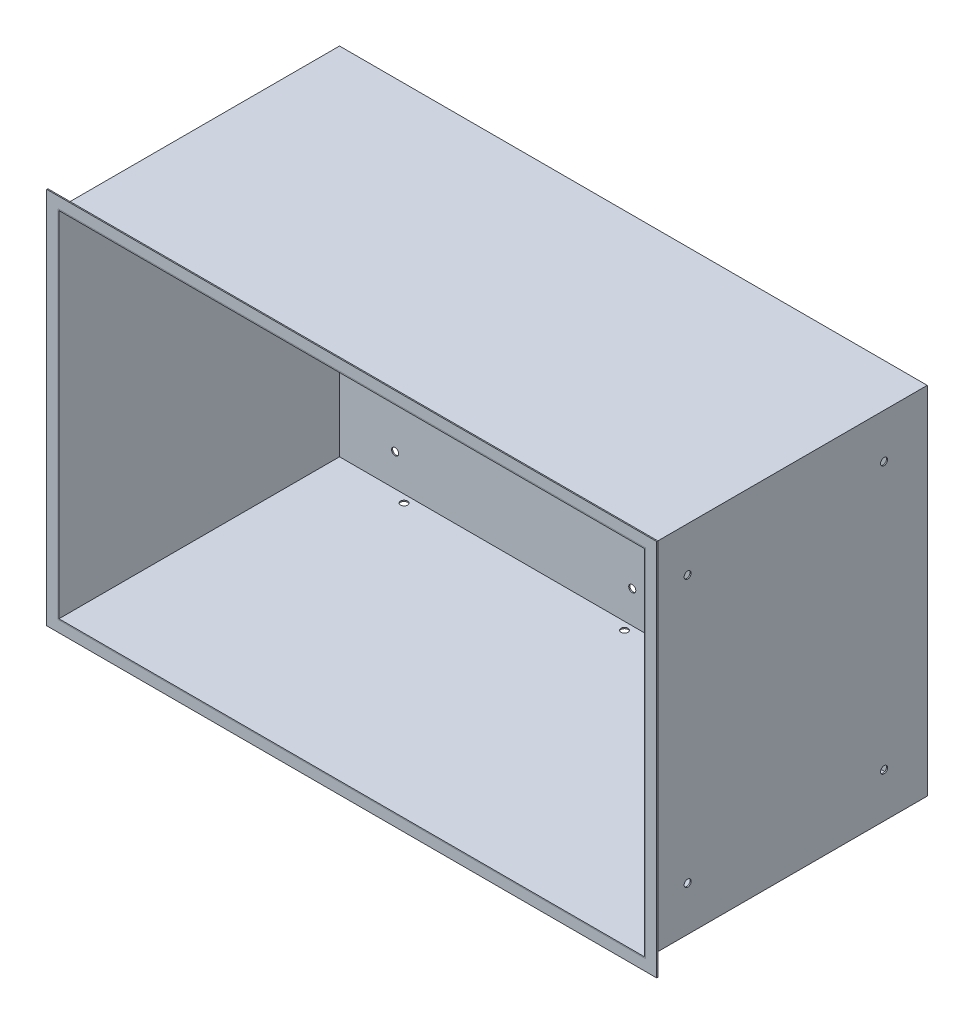
from build123d import *

# Parameters (mm, degrees)
CROQUIS1_W              = 793
CROQUIS1_H              = 380
SALIENTE_EXTRUIR1_DEPTH = 480
VACIADO1_T              = -1.52
CROQUIS2_W              = 823
CROQUIS2_H              = 510
CROQUIS2_W_2            = 793
CROQUIS2_H_2            = 480
SALIENTE_EXTRUIR2_DEPTH = 1.52
CROQUIS3_R              = 4.765
CROQUIS3_R_2            = 4.7625
CORTAR_EXTRUIR1_DEPTH   = 10
CROQUIS4_R              = 4.765
CROQUIS4_R_2            = 4.7625
CORTAR_EXTRUIR2_DEPTH   = 10
CROQUIS5_R              = 4.7625
CORTAR_EXTRUIR3_DEPTH   = 10
CROQUIS6_R              = 12.7
CORTAR_EXTRUIR4_DEPTH   = 10


with BuildPart() as part:
    # Croquis1 → Saliente-Extruir1 (new body)
    with BuildSketch(Plane(origin=(0, 0, 0), x_dir=(1, 0, 0), z_dir=(0, 1, 0))):
        Rectangle(CROQUIS1_W, CROQUIS1_H)
    extrude(amount=SALIENTE_EXTRUIR1_DEPTH)

    # Vaciado1
    vaciado1_openings = [part.faces().sort_by_distance(p)[0] for p in [
        (0, 240, 190),
    ]]
    offset(amount=VACIADO1_T, openings=vaciado1_openings, kind=Kind.INTERSECTION)

    # Croquis3 → Cortar-Extruir1 (cut)
    with BuildSketch(Plane(origin=(396.5, 0, 0), x_dir=(0, 0, -1), z_dir=(1, 0, 0))):
        with Locations((131.74, 60)):
            Circle(CROQUIS3_R)
        with Locations((-133.26, 60)):
            Circle(CROQUIS3_R_2)
        with Locations(Location((131.74, 420, 0), (0, 0, 180))):
            Circle(CROQUIS3_R)
        with Locations(Location((-133.26, 420, 0), (0, 0, 180))):
            Circle(CROQUIS3_R_2)
    extrude(amount=-CORTAR_EXTRUIR1_DEPTH, mode=Mode.SUBTRACT)

    # Croquis4 → Cortar-Extruir2 (cut)
    with BuildSketch(Plane.XY.offset(-188.48)):
        with Locations((-320, 435)):
            Circle(CROQUIS4_R)
        with Locations((-320, 240)):
            Circle(CROQUIS4_R_2)
        with Locations((-320, 45)):
            Circle(CROQUIS4_R)
        with Locations((320, 45)):
            Circle(CROQUIS4_R)
        with Locations((320, 435)):
            Circle(CROQUIS4_R)
        with Locations((320, 240)):
            Circle(CROQUIS4_R_2)
        with Locations((0, 45)):
            Circle(CROQUIS4_R)
        with Locations((0, 435)):
            Circle(CROQUIS4_R)
    extrude(amount=-CORTAR_EXTRUIR2_DEPTH, mode=Mode.SUBTRACT)

    # Croquis5 → Cortar-Extruir3 (cut)
    with BuildSketch(Plane.XZ):
        with Locations(Location((-297.375, -178, 0), (0, 0, 270))):
            Circle(CROQUIS5_R)
        with Locations(Location((0, -178, 0), (0, 0, 270))):
            Circle(CROQUIS5_R)
        with Locations(Location((297.375, -178, 0), (0, 0, 270))):
            Circle(CROQUIS5_R)
    extrude(amount=-CORTAR_EXTRUIR3_DEPTH, mode=Mode.SUBTRACT)

    # Croquis6 → Cortar-Extruir4 (cut)
    with BuildSketch(Plane.XZ):
        with Locations(Location((372.5, -87.8, 0), (0, 0, 270))):
            Circle(CROQUIS6_R)
        with Locations(Location((372.5, -37.4, 0), (0, 0, 270))):
            Circle(CROQUIS6_R)
        with Locations(Location((372.5, 13, 0), (0, 0, 270))):
            Circle(CROQUIS6_R)
    extrude(amount=-CORTAR_EXTRUIR4_DEPTH, mode=Mode.SUBTRACT)


with BuildPart() as body_2:
    # Croquis2 → Saliente-Extruir2 (new body)
    with BuildSketch(Plane.XY.offset(190)):
        with Locations((0, 240)):
            Rectangle(CROQUIS2_W, CROQUIS2_H)
        with Locations((0, 240)):
            Rectangle(CROQUIS2_W_2, CROQUIS2_H_2, mode=Mode.SUBTRACT)
    extrude(amount=-SALIENTE_EXTRUIR2_DEPTH)


solid = Compound([part.part, body_2.part])
